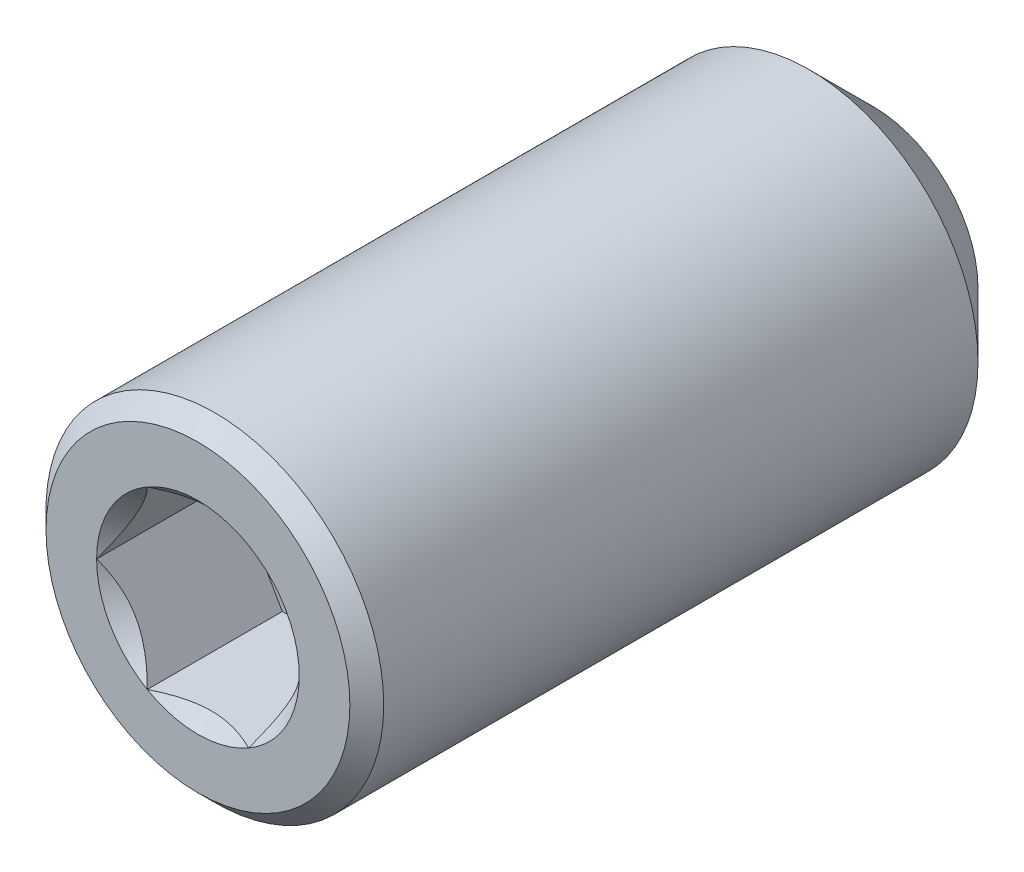
from build123d import *

# Parameters (mm, degrees)
SKETCH1_W          = 2.5
SKETCH1_H          = 10
CUT_EXTRUDE1_DEPTH = 2
CHAMFER1_SIZE      = 0.2505
CHAMFER2_SIZE      = 0.9505


with BuildPart() as part:
    # Sketch1 → Revolve1 (revolve)
    with BuildSketch(Plane(origin=(0, 0, 0), x_dir=(1, 0, 0), z_dir=(0, 1, 0))):
        with Locations((1.25, 0)):
            Rectangle(SKETCH1_W, SKETCH1_H)
    revolve(axis=Axis((0, 0, -5), (0, 0, 1)))

    # Sketch2 → Cut-Extrude1 (cut)
    with BuildSketch(Plane.XY.offset(5)):
        Polygon((-0.75, -1.299038106), (0.75, -1.299038106), (1.5, 0), (0.75, 1.299038106), (-0.75, 1.299038106), (-1.5, 0), align=None)
    extrude(amount=-CUT_EXTRUDE1_DEPTH, mode=Mode.SUBTRACT)

    # Chamfer1
    chamfer1_edges = [part.edges().sort_by_distance(p)[0] for p in [
        (-2.5, 0, 5),
    ]]
    chamfer(chamfer1_edges, length=CHAMFER1_SIZE)

    # Chamfer2
    chamfer2_edges = [part.edges().sort_by_distance(p)[0] for p in [
        (-2.5, 0, -5),
    ]]
    chamfer(chamfer2_edges, length=CHAMFER2_SIZE)

    # Sketch3 → Cut-Revolve1 (revolve, cut)
    with BuildSketch(Plane(origin=(0, 0, 0), x_dir=(1, 0, 0), z_dir=(0, 1, 0))):
        Polygon((0, -3.5), (-1.5, -5), (0, -5), align=None)
    revolve(axis=Axis((0, 0, 3.5), (0, 0, -1)), mode=Mode.SUBTRACT)


solid = part.part
